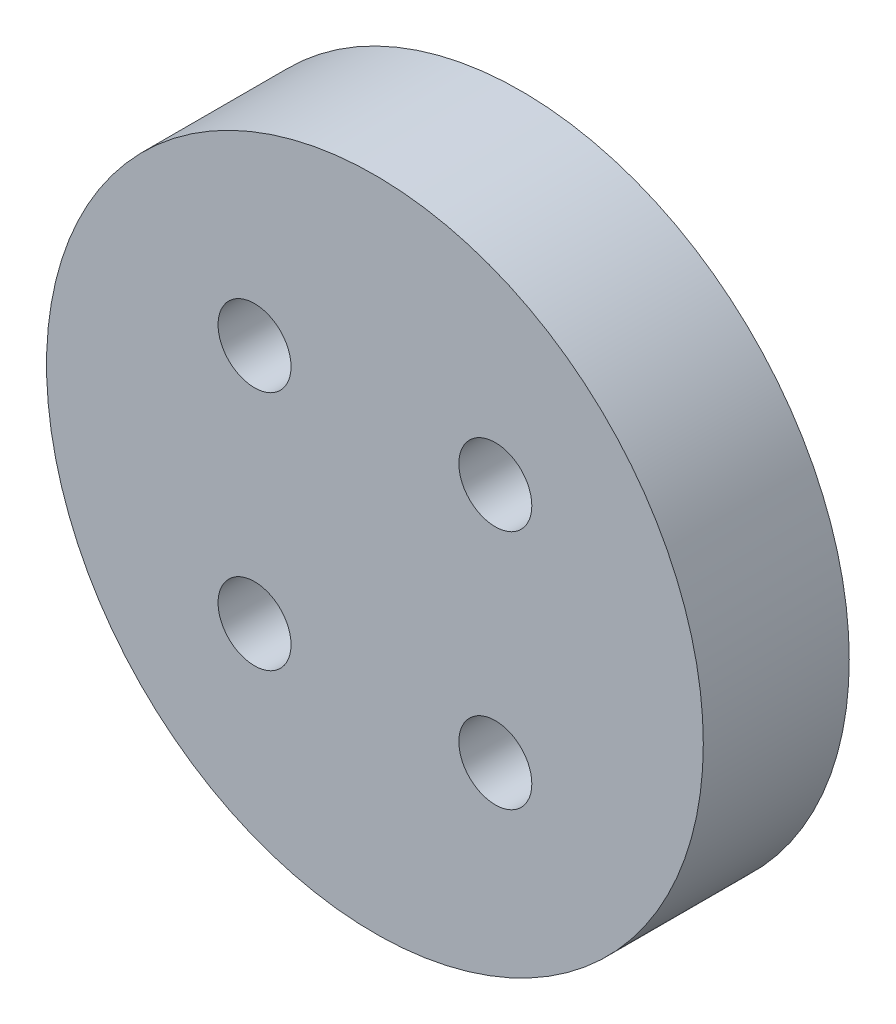
from build123d import *

# Parameters (mm, degrees)
CROQUIS1_R                        = 13.5
SALIENTE_EXTRUIR1_DEPTH           = 6
CROQUIS3_R                        = 1.575
CORTAR_EXTRUIR1_DEPTH             = 1.8
DI_METRO_DE_TALADRO_3_0_3_2_D     = 3
DI_METRO_DE_TALADRO_3_0_3_2_DEPTH = 50
DI_METRO_DE_TALADRO_3_0_3_2_TIP   = 0.901290929


with BuildPart() as part:
    # Croquis1 → Saliente-Extruir1 (new body)
    with BuildSketch(Plane.XY):
        Circle(CROQUIS1_R)
    extrude(amount=SALIENTE_EXTRUIR1_DEPTH)

    # Croquis3 → Cortar-Extruir1 (cut)
    with BuildSketch(Plane(origin=(0, 0, 0), x_dir=(-1, 0, 0), z_dir=(0, 0, -1))):
        with Locations((10.5, 0)):
            Circle(CROQUIS3_R)
        with Locations((-7.5, 0)):
            Circle(CROQUIS3_R)
    extrude(amount=-CORTAR_EXTRUIR1_DEPTH, mode=Mode.SUBTRACT)

    # Diámetro de taladro Ø3.0 (3)2
    with Locations(Plane.XY.offset(6)):
        with Locations((-4.949747468, 4.949747468), (-4.949747468, -4.949747468), (4.949747468, -4.949747468), (4.949747468, 4.949747468)):
            Hole(DI_METRO_DE_TALADRO_3_0_3_2_D / 2, depth=DI_METRO_DE_TALADRO_3_0_3_2_DEPTH)
            with Locations((0, 0, -(DI_METRO_DE_TALADRO_3_0_3_2_DEPTH + DI_METRO_DE_TALADRO_3_0_3_2_TIP / 2))):  # 118° drill point
                Cone(0, DI_METRO_DE_TALADRO_3_0_3_2_D / 2, DI_METRO_DE_TALADRO_3_0_3_2_TIP, mode=Mode.SUBTRACT)


solid = part.part
